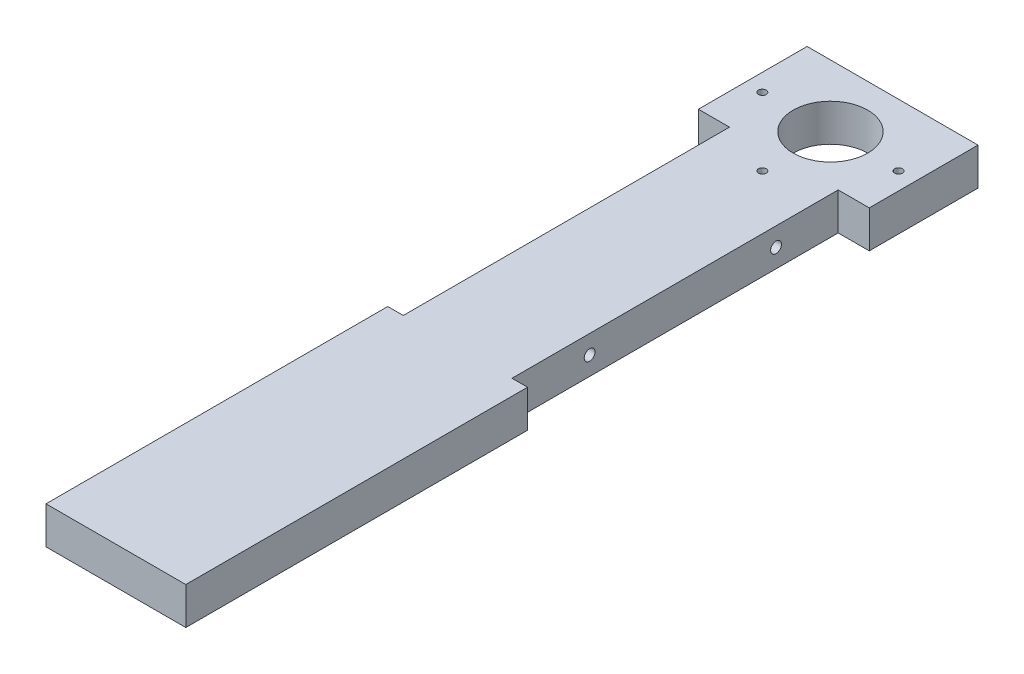
from build123d import *

# Parameters (mm, degrees)
SKETCH1_W           = 45
SKETCH1_H           = 250
BOSS_EXTRUDE1_DEPTH = 12
SKETCH2_W           = 5
SKETCH2_H           = 105
CUT_EXTRUDE1_DEPTH  = 12
SKETCH3_R           = 1.75
CUT_EXTRUDE2_DEPTH  = 35
SKETCH5_W           = 5
SKETCH5_H           = 35
BOSS_EXTRUDE2_DEPTH = 12
SKETCH7_R           = 12
SKETCH7_R_2         = 1.25
CUT_EXTRUDE3_DEPTH  = 35


with BuildPart() as part:
    # Sketch1 → Boss-Extrude1 (new body)
    with BuildSketch(Plane(origin=(0, 0, 0), x_dir=(1, 0, 0), z_dir=(0, 1, 0))):
        Rectangle(SKETCH1_W, SKETCH1_H)
    extrude(amount=BOSS_EXTRUDE1_DEPTH)

    # Sketch2 → Cut-Extrude1 (cut)
    with BuildSketch(Plane(origin=(0, 12, 0), x_dir=(1, 0, 0), z_dir=(0, 1, 0))):
        with Locations((20, 37.5)):
            Rectangle(SKETCH2_W, SKETCH2_H)
        with Locations((-20, 37.5)):
            Rectangle(SKETCH2_W, SKETCH2_H)
    extrude(amount=-CUT_EXTRUDE1_DEPTH, mode=Mode.SUBTRACT)

    # Sketch3 → Cut-Extrude2 (cut)
    with BuildSketch(Plane(origin=(17.5, 0, 0), x_dir=(0, 0, -1), z_dir=(1, 0, 0))):
        with Locations((10, 6)):
            Circle(SKETCH3_R)
        with Locations((70, 6)):
            Circle(SKETCH3_R)
    extrude(amount=-CUT_EXTRUDE2_DEPTH, mode=Mode.SUBTRACT)

    # Sketch5 → Boss-Extrude2 (add)
    with BuildSketch(Plane(origin=(0, 12, 0), x_dir=(1, 0, 0), z_dir=(0, 1, 0))):
        with Locations((25, 107.5)):
            Rectangle(SKETCH5_W, SKETCH5_H)
        with Locations((-25, 107.5)):
            Rectangle(SKETCH5_W, SKETCH5_H)
    extrude(amount=-BOSS_EXTRUDE2_DEPTH)

    # Sketch7 → Cut-Extrude3 (cut)
    with BuildSketch(Plane(origin=(0, 12, 0), x_dir=(1, 0, 0), z_dir=(0, 1, 0))):
        with Locations(Location((0, 105, 0), (0, 0, 270))):
            Circle(SKETCH7_R)
        with Locations(Location((21.920310217, 105, 0), (0, 0, 270))):
            Circle(SKETCH7_R_2)
        with Locations(Location((-21.920310217, 105, 0), (0, 0, 270))):
            Circle(SKETCH7_R_2)
        with Locations(Location((0, 83.079689783, 0), (0, 0, 270))):
            Circle(SKETCH7_R_2)
    extrude(amount=-CUT_EXTRUDE3_DEPTH, mode=Mode.SUBTRACT)


solid = part.part
